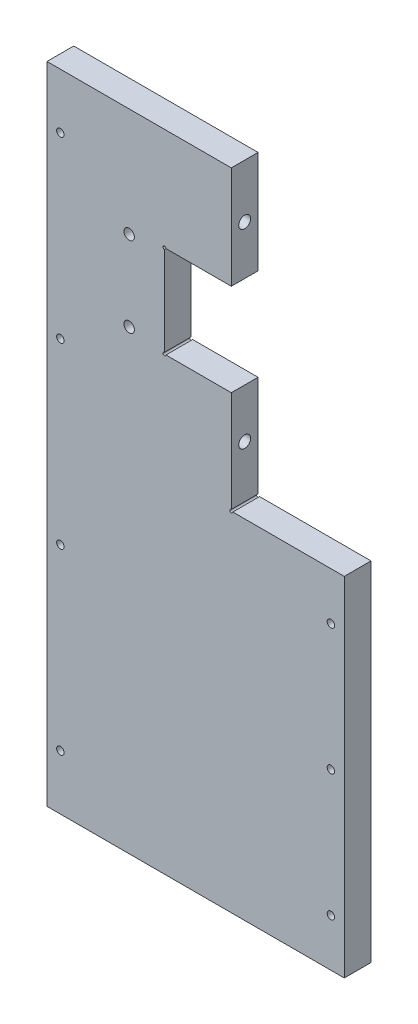
from build123d import *

# Parameters (mm, degrees)
BOSS_EXTRUDE1_DEPTH          = 18
SKETCH2_R                    = 1
CUT_EXTRUDE1_DEPTH           = 18
F_5_0_5_DIAMETER_HOLE1_D     = 5
F_5_0_5_DIAMETER_HOLE2_D     = 5
F_8_0_8_DIAMETER_HOLE1_D     = 8
F_8_0_8_DIAMETER_HOLE1_DEPTH = 26
F_7_0_7_DIAMETER_HOLE1_D     = 7


with BuildPart() as part:
    # Sketch1 → Boss-Extrude1 (new body)
    with BuildSketch(Plane.XY):
        Polygon((200, 234), (124, 234), (124, 303), (79, 303), (79, 365), (124, 365), (124, 434), (0, 434), (0, 0), (200, 0), align=None)
    extrude(amount=BOSS_EXTRUDE1_DEPTH)

    # Sketch2 → Cut-Extrude1 (cut)
    with BuildSketch(Plane.XY.offset(18)):
        with Locations((79, 365)):
            Circle(SKETCH2_R)
        with Locations((79, 303)):
            Circle(SKETCH2_R)
        with Locations((124, 234)):
            Circle(SKETCH2_R)
    extrude(amount=-CUT_EXTRUDE1_DEPTH, mode=Mode.SUBTRACT)

    # Ø5.0 (5) Diameter Hole1 (through all)
    with Locations(Plane.XY.offset(18)):
        with Locations((9, 397), (9, 277), (9, 157), (9, 37)):
            Hole(F_5_0_5_DIAMETER_HOLE1_D / 2)

    # Ø5.0 (5) Diameter Hole2 (through all)
    with Locations(Plane(origin=(0, 0, 0), x_dir=(-1, 0, 0), z_dir=(0, 0, -1))):
        with Locations((-191, 202), (-191, 117), (-191, 32)):
            Hole(F_5_0_5_DIAMETER_HOLE2_D / 2)

    # Ø8.0 (8) Diameter Hole1
    with Locations(Plane(origin=(124, 0, 0), x_dir=(0, 0, -1), z_dir=(1, 0, 0))):
        with Locations((-9, 398), (-9, 270)):
            Hole(F_8_0_8_DIAMETER_HOLE1_D / 2, depth=F_8_0_8_DIAMETER_HOLE1_DEPTH)

    # Ø7.0 (7) Diameter Hole1 (through all)
    with Locations(Plane.XY.offset(18)):
        with Locations((55.287909583, 361), (55.287909583, 307)):
            Hole(F_7_0_7_DIAMETER_HOLE1_D / 2)


solid = part.part
